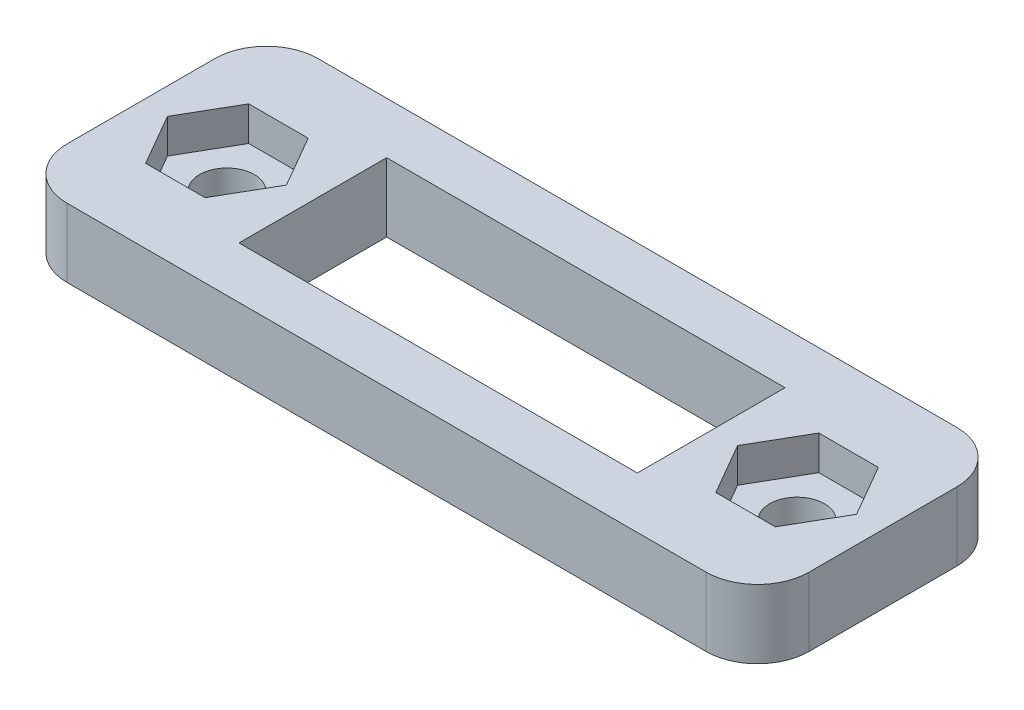
from build123d import *

# Parameters (mm, degrees)
SKETCH1_W           = 43.2
SKETCH1_H           = 14.6
SKETCH1_W_2         = 23.2
SKETCH1_H_2         = 8.6
BOSS_EXTRUDE1_DEPTH = 4
CUT_EXTRUDE1_DEPTH  = 2
SKETCH5_R           = 1.6
CUT_EXTRUDE2_DEPTH  = 23.88776966
FILLET2_R           = 3


with BuildPart() as part:
    # Sketch1 → Boss-Extrude1 (new body)
    with BuildSketch(Plane(origin=(0, 0, 0), x_dir=(1, 0, 0), z_dir=(0, 1, 0))):
        Rectangle(SKETCH1_W, SKETCH1_H)
        Rectangle(SKETCH1_W_2, SKETCH1_H_2, mode=Mode.SUBTRACT)
    extrude(amount=BOSS_EXTRUDE1_DEPTH)

    # Sketch4 → Cut-Extrude1 (cut)
    with BuildSketch(Plane(origin=(0, 4, 0), x_dir=(1, 0, 0), z_dir=(0, 1, 0))):
        Polygon((18.332050808, -3), (20.064101615, 0), (18.332050808, 3), (14.867949192, 3), (13.135898385, 0), (14.867949192, -3), align=None)
        Polygon((-14.867949192, -3), (-18.332050808, -3), (-20.064101615, 0), (-18.332050808, 3), (-14.867949192, 3), (-13.135898385, 0), align=None)
    extrude(amount=-CUT_EXTRUDE1_DEPTH, mode=Mode.SUBTRACT)

    # Sketch5 → Cut-Extrude2 (cut, through all)
    with BuildSketch(Plane(origin=(0, 2, 0), x_dir=(1, 0, 0), z_dir=(0, 1, 0))):
        with Locations(Location((-16.6, 0, 0), (0, 0, 270))):
            Circle(SKETCH5_R)
        with Locations(Location((16.6, 0, 0), (0, 0, 90))):
            Circle(SKETCH5_R)
    extrude(amount=-CUT_EXTRUDE2_DEPTH, mode=Mode.SUBTRACT)

    # Fillet2
    fillet2_edges = [part.edges().sort_by_distance(p)[0] for p in [
        (-21.6, 2, -7.3),
        (21.6, 2, -7.3),
        (21.6, 2, 7.3),
        (-21.6, 2, 7.3),
    ]]
    fillet(fillet2_edges, radius=FILLET2_R)


solid = part.part
